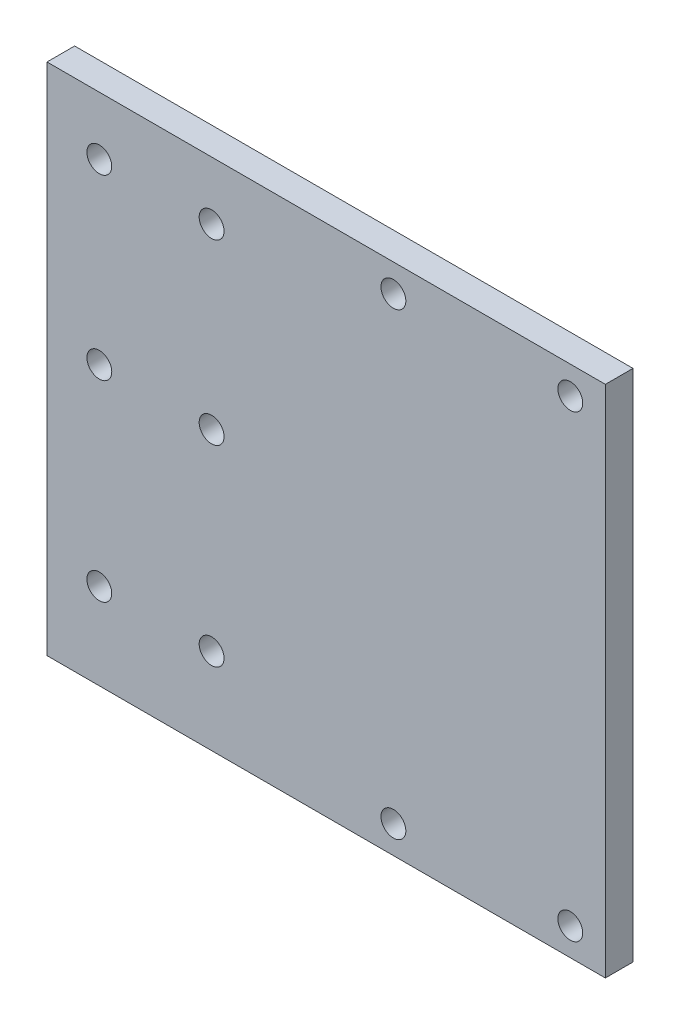
from build123d import *

# Parameters (mm, degrees)
ESQUISSE1_W        = 101
ESQUISSE1_H        = 93
BOSS_EXTRU_1_DEPTH = 5
D_GAGEMENT_M41_D   = 4.5
D_GAGEMENT_M42_D   = 4.5


with BuildPart() as part:
    # Esquisse1 → Boss.-Extru.1 (new body)
    with BuildSketch(Plane.XY):
        Rectangle(ESQUISSE1_W, ESQUISSE1_H)
    extrude(amount=BOSS_EXTRU_1_DEPTH)

    # Dégagement M41 (through all)
    with Locations(Plane.XY.offset(5)):
        with Locations((44.157879946, 41.5), (12.157879946, 41.5), (12.157879946, -41.5), (44.157879946, -41.5)):
            Hole(D_GAGEMENT_M41_D / 2)

    # Dégagement M42 (through all)
    with Locations(Plane.XY.offset(5)):
        with Locations((-20.723129893, -30.91293976), (-20.723129893, 3.803464199), (-41.035821543, 3.803464199), (-41.035821543, -30.91293976), (-41.035821543, 35.983767161), (-20.723129893, 35.983767161)):
            Hole(D_GAGEMENT_M42_D / 2)


solid = part.part
